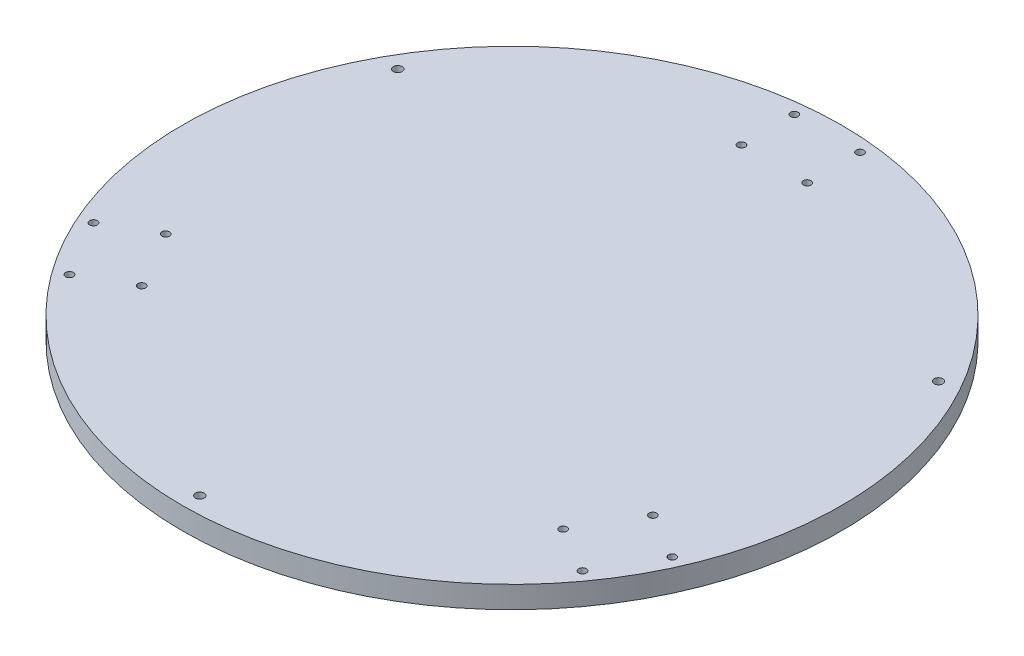
from build123d import *

# Parameters (mm, degrees)
SKETCH1_R           = 150
BOSS_EXTRUDE1_DEPTH = 10
SKETCH2_R           = 1.73
SKETCH2_R_2         = 2
CUT_EXTRUDE1_DEPTH  = 10


with BuildPart() as part:
    # Sketch1 → Boss-Extrude1 (new body)
    with BuildSketch(Plane(origin=(0, 0, 0), x_dir=(1, 0, 0), z_dir=(0, 1, 0))):
        with Locations(Location((0, 0, 0), (0, 0, 270))):
            Circle(SKETCH1_R)
    extrude(amount=BOSS_EXTRUDE1_DEPTH)

    # Sketch2 → Cut-Extrude1 (cut)
    with BuildSketch(Plane(origin=(0, 10, 0), x_dir=(1, 0, 0), z_dir=(0, 1, 0))):
        with Locations(Location((-14.945, 143.452697854, 0), (0, 0, 270))):
            Circle(SKETCH2_R)
        with Locations(Location((-14.945, 119.392697854, 0), (0, 0, 270))):
            Circle(SKETCH2_R)
        with Locations(Location((14.945, 143.452697854, 0), (0, 0, 90))):
            Circle(SKETCH2_R)
        with Locations(Location((14.945, 119.392697854, 0), (0, 0, 90))):
            Circle(SKETCH2_R)
        with Locations(Location((95.924609368, -72.639098587, 0), (0, 0, 90))):
            Circle(SKETCH2_R)
        with Locations(Location((116.761180583, -84.669098587, 0), (0, 0, 90))):
            Circle(SKETCH2_R)
        with Locations(Location((131.706180583, -58.783599268, 0), (0, 0, 270))):
            Circle(SKETCH2_R)
        with Locations(Location((110.869609368, -46.753599268, 0), (0, 0, 270))):
            Circle(SKETCH2_R)
        with Locations(Location((-110.869609368, -46.753599268, 0), (0, 0, 90))):
            Circle(SKETCH2_R)
        with Locations(Location((-131.706180583, -58.783599268, 0), (0, 0, 90))):
            Circle(SKETCH2_R)
        with Locations(Location((-116.761180583, -84.669098587, 0), (0, 0, 270))):
            Circle(SKETCH2_R)
        with Locations(Location((-95.924609368, -72.639098587, 0), (0, 0, 270))):
            Circle(SKETCH2_R)
        with Locations(Location((-123.062136008, 71.049957351, 0), (0, 0, 270))):
            Circle(SKETCH2_R_2)
        with Locations(Location((123.062136008, 71.049957351, 0), (0, 0, 270))):
            Circle(SKETCH2_R_2)
        with Locations(Location((0, -142.099914702, 0), (0, 0, 270))):
            Circle(SKETCH2_R_2)
    extrude(amount=-CUT_EXTRUDE1_DEPTH, mode=Mode.SUBTRACT)


solid = part.part
